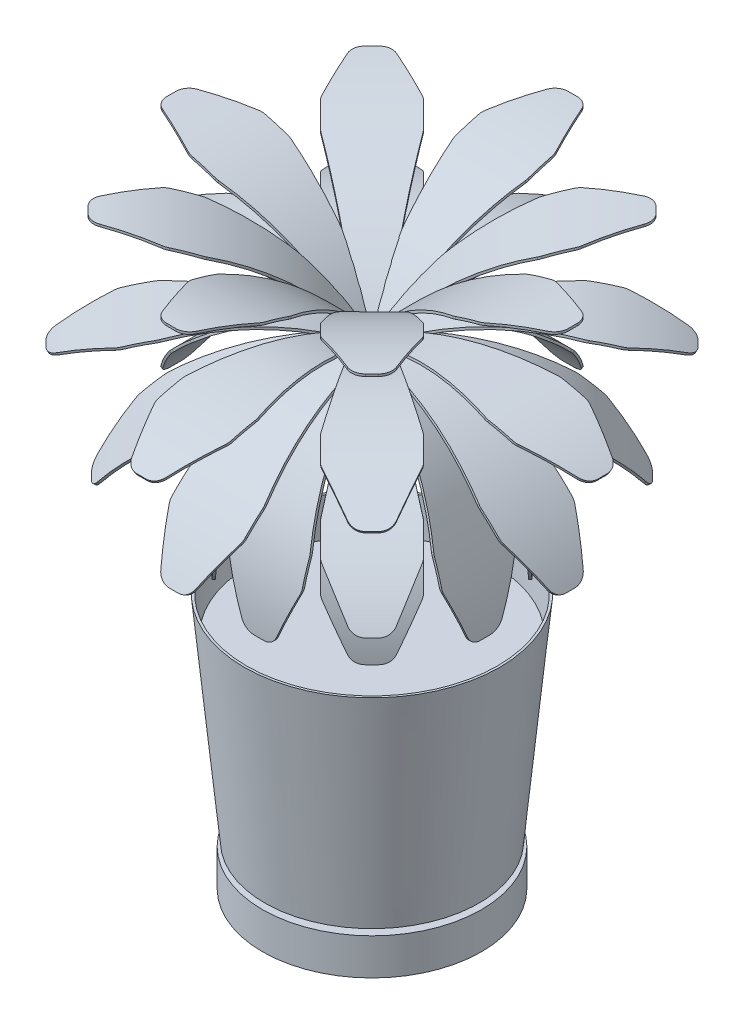
from build123d import *

# Parameters (mm, degrees)
SKETCH3_R           = 9.525
BOSS_EXTRUDE1_DEPTH = 177.8
BOSS_EXTRUDE1_TAPER = 2
BOSS_EXTRUDE2_DEPTH = 25.4
SKETCH5_OUTSIDE_W   = 263.022
SKETCH5_OUTSIDE_H   = 416.765
CUT_EXTRUDE1_DEPTH  = 355.580540036
FILLET6_R           = 9.525
CIRPATTERN2_COUNT   = 4
CIRPATTERN2_ANGLE   = 90
CIRPATTERN3_COUNT   = 8


with BuildPart() as part:
    # Sketch1 → Revolve1 (revolve)
    with BuildSketch(Plane.XY, mode=Mode.PRIVATE) as revolve1_sk:
        Polygon((0, 0), (0, 152.4), (84.873325365, 152.4), (87.305240259, 177.8), (88.9, 177.8), (74.6125, 28.575), (69.85, 28.575), (69.85, 25.4), (76.2, 25.4), (76.2, 0), align=None)
    revolve(revolve1_sk.sketch.rotate(Axis((0, 0, 0), (0, -1, 0)), 180), axis=Axis((0, 0, 0), (0, -1, 0)))


with BuildPart() as body_2:
    # Sketch3 → Boss-Extrude1 (new body)
    with BuildSketch(Plane(origin=(0, 152.4, 0), x_dir=(1, 0, 0), z_dir=(0, 1, 0))):
        Circle(SKETCH3_R)
    extrude(amount=BOSS_EXTRUDE1_DEPTH, taper=BOSS_EXTRUDE1_TAPER)


with BuildPart() as body_3:
    # Sketch4 → Boss-Extrude2 (new, symmetric)
    with BuildSketch(Plane.XY):
        with BuildLine():
            Line((77.111818976, 190.5), (78.699318976, 190.5))
            ThreePointArc((78.699318976, 190.5), (57.943784129, 271.051748602), (0.846040202, 331.543269231))
            Line((0.846040202, 331.543269231), (0, 330.2))
            ThreePointArc((0, 330.2), (56.553955889, 270.284589091), (77.111818976, 190.5))
        make_face()
    extrude(amount=BOSS_EXTRUDE2_DEPTH, both=True)

    # Sketch5 outside → Cut-Extrude1 (cut, through all)
    with BuildSketch(Plane(origin=(0, 0, 0), x_dir=(0, 0, -1), z_dir=(1, 0, 0))):
        with Locations((0, 165.7715)):
            Rectangle(SKETCH5_OUTSIDE_W, SKETCH5_OUTSIDE_H)
        Polygon((-9.525, 190.5), (-25.4, 228.6), (-25.4, 247.65), (-6.35, 331.543269231), (6.35, 331.543269231), (25.4, 247.65), (25.4, 228.6), (9.525, 190.5), align=None, mode=Mode.SUBTRACT)
    extrude(amount=CUT_EXTRUDE1_DEPTH, mode=Mode.SUBTRACT)

    # Fillet6
    fillet6_edges = [body_3.edges().sort_by_distance(p)[0] for p in [
        (73.471074534, 228.6, 25.4),
        (67.750474889, 247.65, 25.4),
        (67.750474889, 247.65, -25.4),
        (73.471074534, 228.6, -25.4),
        (77.905568976, 190.5, 9.525),
        (77.905568976, 190.5, -9.525),
    ]]
    fillet(fillet6_edges, radius=FILLET6_R)


with BuildPart() as cirpattern2_1:
    # CirPattern2: pattern copy
    add(body_3.part.rotate(Axis((0, 330.2, 0), (0, 0, 1)), 1 * CIRPATTERN2_ANGLE / (CIRPATTERN2_COUNT - 1)))


with BuildPart() as cirpattern2_2:
    # CirPattern2: pattern copy
    add(body_3.part.rotate(Axis((0, 330.2, 0), (0, 0, 1)), 2 * CIRPATTERN2_ANGLE / (CIRPATTERN2_COUNT - 1)))


with BuildPart() as cirpattern2_3:
    # CirPattern2: pattern copy
    add(body_3.part.rotate(Axis((0, 330.2, 0), (0, 0, 1)), 3 * CIRPATTERN2_ANGLE / (CIRPATTERN2_COUNT - 1)))


with BuildPart() as cirpattern3_1:
    # CirPattern3: pattern copy
    add(cirpattern2_3.part.rotate(Axis((0, 0, 0), (0, 1, 0)), 1 * 360 / CIRPATTERN3_COUNT))


with BuildPart() as cirpattern3_2:
    # CirPattern3: pattern copy
    add(cirpattern2_3.part.rotate(Axis((0, 0, 0), (0, 1, 0)), 2 * 360 / CIRPATTERN3_COUNT))


with BuildPart() as cirpattern3_3:
    # CirPattern3: pattern copy
    add(cirpattern2_3.part.rotate(Axis((0, 0, 0), (0, 1, 0)), 3 * 360 / CIRPATTERN3_COUNT))


with BuildPart() as cirpattern3_4:
    # CirPattern3: pattern copy
    add(cirpattern2_3.part.rotate(Axis((0, 0, 0), (0, 1, 0)), 4 * 360 / CIRPATTERN3_COUNT))


with BuildPart() as cirpattern3_5:
    # CirPattern3: pattern copy
    add(cirpattern2_3.part.rotate(Axis((0, 0, 0), (0, 1, 0)), 5 * 360 / CIRPATTERN3_COUNT))


with BuildPart() as cirpattern3_6:
    # CirPattern3: pattern copy
    add(cirpattern2_3.part.rotate(Axis((0, 0, 0), (0, 1, 0)), 6 * 360 / CIRPATTERN3_COUNT))


with BuildPart() as cirpattern3_7:
    # CirPattern3: pattern copy
    add(cirpattern2_3.part.rotate(Axis((0, 0, 0), (0, 1, 0)), 7 * 360 / CIRPATTERN3_COUNT))


with BuildPart() as cirpattern3_8:
    # CirPattern3: pattern copy
    add(cirpattern2_2.part.rotate(Axis((0, 0, 0), (0, 1, 0)), 1 * 360 / CIRPATTERN3_COUNT))


with BuildPart() as cirpattern3_9:
    # CirPattern3: pattern copy
    add(cirpattern2_2.part.rotate(Axis((0, 0, 0), (0, 1, 0)), 2 * 360 / CIRPATTERN3_COUNT))


with BuildPart() as cirpattern3_10:
    # CirPattern3: pattern copy
    add(cirpattern2_2.part.rotate(Axis((0, 0, 0), (0, 1, 0)), 3 * 360 / CIRPATTERN3_COUNT))


with BuildPart() as cirpattern3_11:
    # CirPattern3: pattern copy
    add(cirpattern2_2.part.rotate(Axis((0, 0, 0), (0, 1, 0)), 4 * 360 / CIRPATTERN3_COUNT))


with BuildPart() as cirpattern3_12:
    # CirPattern3: pattern copy
    add(cirpattern2_2.part.rotate(Axis((0, 0, 0), (0, 1, 0)), 5 * 360 / CIRPATTERN3_COUNT))


with BuildPart() as cirpattern3_13:
    # CirPattern3: pattern copy
    add(cirpattern2_2.part.rotate(Axis((0, 0, 0), (0, 1, 0)), 6 * 360 / CIRPATTERN3_COUNT))


with BuildPart() as cirpattern3_14:
    # CirPattern3: pattern copy
    add(cirpattern2_2.part.rotate(Axis((0, 0, 0), (0, 1, 0)), 7 * 360 / CIRPATTERN3_COUNT))


with BuildPart() as cirpattern3_15:
    # CirPattern3: pattern copy
    add(cirpattern2_1.part.rotate(Axis((0, 0, 0), (0, 1, 0)), 1 * 360 / CIRPATTERN3_COUNT))


with BuildPart() as cirpattern3_16:
    # CirPattern3: pattern copy
    add(cirpattern2_1.part.rotate(Axis((0, 0, 0), (0, 1, 0)), 2 * 360 / CIRPATTERN3_COUNT))


with BuildPart() as cirpattern3_17:
    # CirPattern3: pattern copy
    add(cirpattern2_1.part.rotate(Axis((0, 0, 0), (0, 1, 0)), 3 * 360 / CIRPATTERN3_COUNT))


with BuildPart() as cirpattern3_18:
    # CirPattern3: pattern copy
    add(cirpattern2_1.part.rotate(Axis((0, 0, 0), (0, 1, 0)), 4 * 360 / CIRPATTERN3_COUNT))


with BuildPart() as cirpattern3_19:
    # CirPattern3: pattern copy
    add(cirpattern2_1.part.rotate(Axis((0, 0, 0), (0, 1, 0)), 5 * 360 / CIRPATTERN3_COUNT))


with BuildPart() as cirpattern3_20:
    # CirPattern3: pattern copy
    add(cirpattern2_1.part.rotate(Axis((0, 0, 0), (0, 1, 0)), 6 * 360 / CIRPATTERN3_COUNT))


with BuildPart() as cirpattern3_21:
    # CirPattern3: pattern copy
    add(cirpattern2_1.part.rotate(Axis((0, 0, 0), (0, 1, 0)), 7 * 360 / CIRPATTERN3_COUNT))


with BuildPart() as cirpattern3_22:
    # CirPattern3: pattern copy
    add(body_3.part.rotate(Axis((0, 0, 0), (0, 1, 0)), 1 * 360 / CIRPATTERN3_COUNT))


with BuildPart() as cirpattern3_23:
    # CirPattern3: pattern copy
    add(body_3.part.rotate(Axis((0, 0, 0), (0, 1, 0)), 2 * 360 / CIRPATTERN3_COUNT))


with BuildPart() as cirpattern3_24:
    # CirPattern3: pattern copy
    add(body_3.part.rotate(Axis((0, 0, 0), (0, 1, 0)), 3 * 360 / CIRPATTERN3_COUNT))


with BuildPart() as cirpattern3_25:
    # CirPattern3: pattern copy
    add(body_3.part.rotate(Axis((0, 0, 0), (0, 1, 0)), 4 * 360 / CIRPATTERN3_COUNT))


with BuildPart() as cirpattern3_26:
    # CirPattern3: pattern copy
    add(body_3.part.rotate(Axis((0, 0, 0), (0, 1, 0)), 5 * 360 / CIRPATTERN3_COUNT))


with BuildPart() as cirpattern3_27:
    # CirPattern3: pattern copy
    add(body_3.part.rotate(Axis((0, 0, 0), (0, 1, 0)), 6 * 360 / CIRPATTERN3_COUNT))


with BuildPart() as cirpattern3_28:
    # CirPattern3: pattern copy
    add(body_3.part.rotate(Axis((0, 0, 0), (0, 1, 0)), 7 * 360 / CIRPATTERN3_COUNT))


solid = Compound([part.part, body_2.part, body_3.part, cirpattern2_1.part, cirpattern2_2.part, cirpattern2_3.part, cirpattern3_1.part, cirpattern3_2.part, cirpattern3_3.part, cirpattern3_4.part, cirpattern3_5.part, cirpattern3_6.part, cirpattern3_7.part, cirpattern3_8.part, cirpattern3_9.part, cirpattern3_10.part, cirpattern3_11.part, cirpattern3_12.part, cirpattern3_13.part, cirpattern3_14.part, cirpattern3_15.part, cirpattern3_16.part, cirpattern3_17.part, cirpattern3_18.part, cirpattern3_19.part, cirpattern3_20.part, cirpattern3_21.part, cirpattern3_22.part, cirpattern3_23.part, cirpattern3_24.part, cirpattern3_25.part, cirpattern3_26.part, cirpattern3_27.part, cirpattern3_28.part])
